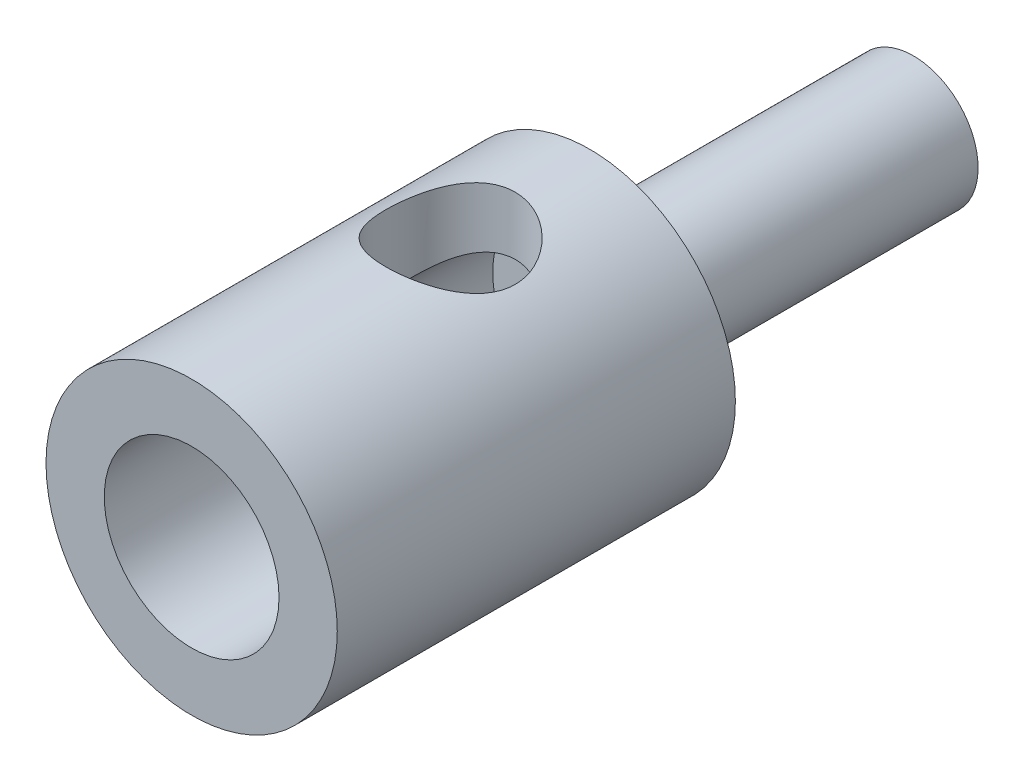
from build123d import *

# Parameters (mm, degrees)
SKETCH1_R           = 2.25
BOSS_EXTRUDE1_DEPTH = 6.15
SKETCH2_R           = 1
BOSS_EXTRUDE2_DEPTH = 5
SKETCH3_R           = 1.35
CUT_EXTRUDE1_DEPTH  = 6
SKETCH4_R           = 1
CUT_EXTRUDE2_DEPTH  = 6


with BuildPart() as part:
    # Sketch1 → Boss-Extrude1 (new body)
    with BuildSketch(Plane.XY):
        Circle(SKETCH1_R)
    extrude(amount=BOSS_EXTRUDE1_DEPTH)

    # Sketch2 → Boss-Extrude2 (add)
    with BuildSketch(Plane(origin=(0, 0, 0), x_dir=(-1, 0, 0), z_dir=(0, 0, -1))):
        Circle(SKETCH2_R)
    extrude(amount=BOSS_EXTRUDE2_DEPTH)

    # Sketch3 → Cut-Extrude1 (cut)
    with BuildSketch(Plane.XY.offset(6.15)):
        Circle(SKETCH3_R)
    extrude(amount=-CUT_EXTRUDE1_DEPTH, mode=Mode.SUBTRACT)

    # Sketch4 → Cut-Extrude2 (cut)
    with BuildSketch(Plane(origin=(0, -2.25, 0), x_dir=(-1, 0, 0), z_dir=(0, -1, 0))):
        with Locations(Location((0, -2.15, 0), (0, 0, 90))):
            Circle(SKETCH4_R)
    extrude(amount=-CUT_EXTRUDE2_DEPTH, mode=Mode.SUBTRACT)


solid = part.part
